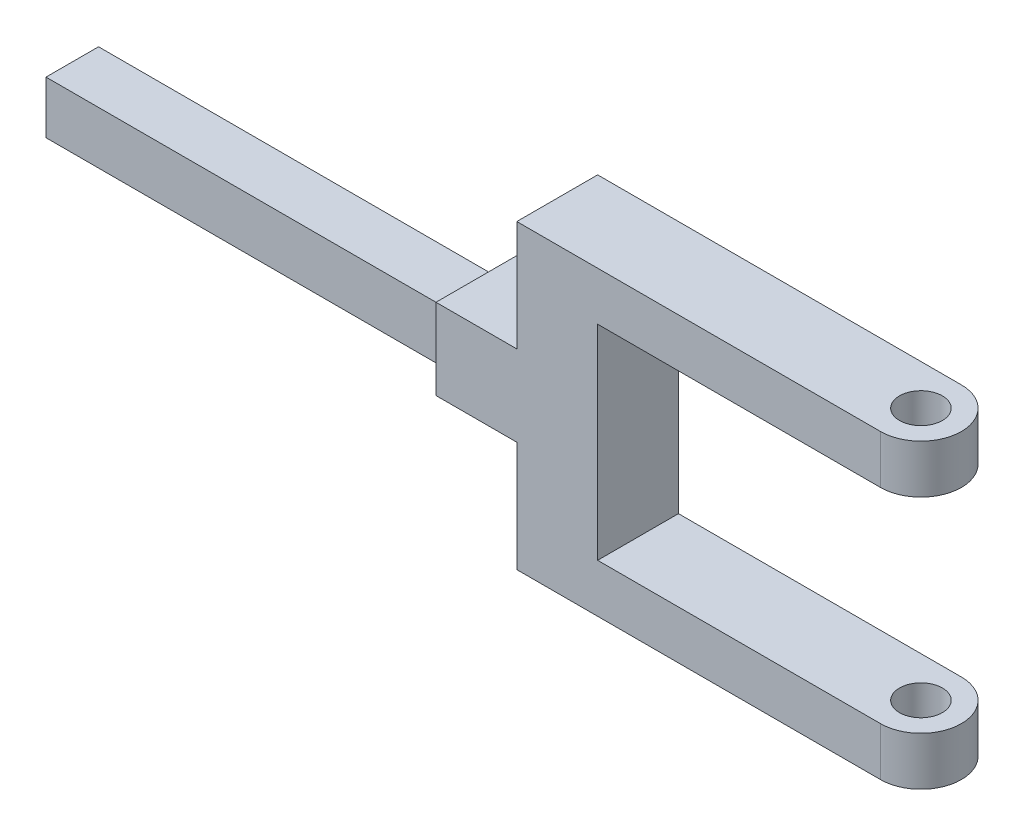
from build123d import *

# Parameters (mm, degrees)
EXTRUDE_1_DEPTH     = 10
SKETCH_2_W          = 10
SKETCH_2_H          = 10
SKETCH_2_W_2        = 6.5
SKETCH_2_H_2        = 6.5
EXTRUDE_2_DEPTH     = 10
EXTRUDE_START       = 10
SKETCH_2_3_W        = 6.5
SKETCH_2_3_H        = 6.5
EXTRUDE_3_DEPTH     = 50
CUT_EXTRUDE_1_DEPTH = 80.945543966


with BuildPart() as part:
    # 草图1 → 凸台-拉伸1 (new body)
    with BuildSketch(Plane.XY):
        Polygon((0, 12.65), (0, -12.65), (40, -12.65), (40, -18.65), (-10, -18.65), (-10, 18.65), (40, 18.65), (40, 12.65), align=None)
    extrude(amount=EXTRUDE_1_DEPTH)

    # 草图2 → 凸台-拉伸2 (add)
    # profile 1 of 2: a face of its own
    with BuildSketch(Plane.ZY.offset(10)):
        with Locations((5, 0)):
            Rectangle(SKETCH_2_W, SKETCH_2_H)
        with Locations((5, 0)):
            Rectangle(SKETCH_2_W_2, SKETCH_2_H_2, mode=Mode.SUBTRACT)
    # profile 2 of 2: a face of its own
    with BuildSketch(Plane.ZY.offset(10)):
        with Locations((5, 0)):
            Rectangle(SKETCH_2_W_2, SKETCH_2_H_2)
    extrude(amount=EXTRUDE_2_DEPTH)

    # 草图2<3> → 凸台-拉伸3 (add)
    with BuildSketch(Plane.ZY.offset(10).offset(EXTRUDE_START)):
        with Locations((5, 0)):
            Rectangle(SKETCH_2_3_W, SKETCH_2_3_H)
    extrude(amount=EXTRUDE_3_DEPTH)

    # 草图3 → 切除-拉伸1 (cut, through all)
    with BuildSketch(Plane(origin=(0, 18.65, 0), x_dir=(1, 0, 0), z_dir=(0, 1, 0))):
        with BuildLine():
            ThreePointArc((32.35, -5), (35, -7.65), (37.65, -5))
            Line((37.65, -5), (32.35, -5))
        make_face()
        with BuildLine():
            Line((32.35, -5), (37.65, -5))
            ThreePointArc((37.65, -5), (35, -2.35), (32.35, -5))
        make_face()
        with BuildLine():
            ThreePointArc((35, 0), (38.535533906, -1.464466094), (40, -5))
            Line((40, -5), (40, 0))
            Line((40, 0), (35, 0))
        make_face()
        with BuildLine():
            Line((40, -10), (40, -5))
            ThreePointArc((40, -5), (38.535533906, -8.535533906), (35, -10))
            Line((35, -10), (40, -10))
        make_face()
    extrude(amount=-CUT_EXTRUDE_1_DEPTH, mode=Mode.SUBTRACT)


solid = part.part
